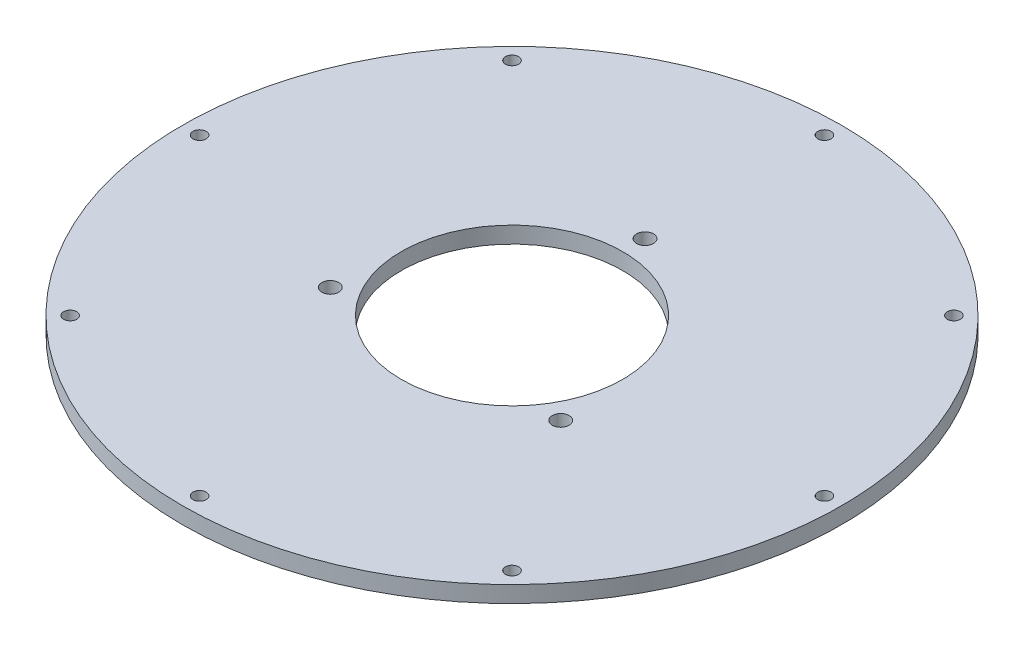
from build123d import *

# Parameters (mm, degrees)
SKETCH1_R           = 62.5
SKETCH1_R_2         = 21
BOSS_EXTRUDE1_DEPTH = 3.125
SKETCH2_R           = 1.6
CUT_EXTRUDE1_DEPTH  = 89.443573113
SKETCH6_R           = 1.25
CUT_EXTRUDE3_DEPTH  = 89.443573113


with BuildPart() as part:
    # Sketch1 → Boss-Extrude1 (new body)
    with BuildSketch(Plane(origin=(0, 0, 0), x_dir=(1, 0, 0), z_dir=(0, 1, 0))):
        with Locations(Location((0, 0, 0), (0, 0, 270))):
            Circle(SKETCH1_R)
        with Locations(Location((0, 0, 0), (0, 0, 270))):
            Circle(SKETCH1_R_2, mode=Mode.SUBTRACT)
    extrude(amount=BOSS_EXTRUDE1_DEPTH)

    # Sketch2 → Cut-Extrude1 (cut, through all)
    with BuildSketch(Plane(origin=(0, 3.125, 0), x_dir=(1, 0, 0), z_dir=(0, 1, 0))):
        with Locations(Location((0, 25.225, 0), (0, 0, 270))):
            Circle(SKETCH2_R)
        with Locations(Location((21.84549081, -12.6125, 0), (0, 0, 270))):
            Circle(SKETCH2_R)
        with Locations(Location((-21.84549081, -12.6125, 0), (0, 0, 270))):
            Circle(SKETCH2_R)
    extrude(amount=-CUT_EXTRUDE1_DEPTH, mode=Mode.SUBTRACT)

    # Sketch6 → Cut-Extrude3 (cut, through all)
    with BuildSketch(Plane(origin=(0, 3.125, 0), x_dir=(1, 0, 0), z_dir=(0, 1, 0))):
        with Locations(Location((-41.896076785, 41.896076785, 0), (0, 0, 270))):
            Circle(SKETCH6_R)
        with Locations(Location((41.896076785, 41.896076785, 0), (0, 0, 270))):
            Circle(SKETCH6_R)
        with Locations(Location((-41.896076785, -41.896076785, 0), (0, 0, 270))):
            Circle(SKETCH6_R)
        with Locations(Location((41.896076785, -41.896076785, 0), (0, 0, 270))):
            Circle(SKETCH6_R)
        with Locations(Location((-59.25, 0, 0), (0, 0, 270))):
            Circle(SKETCH6_R)
        with Locations(Location((59.25, 0, 0), (0, 0, 270))):
            Circle(SKETCH6_R)
        with Locations(Location((0, 59.25, 0), (0, 0, 270))):
            Circle(SKETCH6_R)
        with Locations(Location((0, -59.25, 0), (0, 0, 270))):
            Circle(SKETCH6_R)
    extrude(amount=-CUT_EXTRUDE3_DEPTH, mode=Mode.SUBTRACT)


solid = part.part
